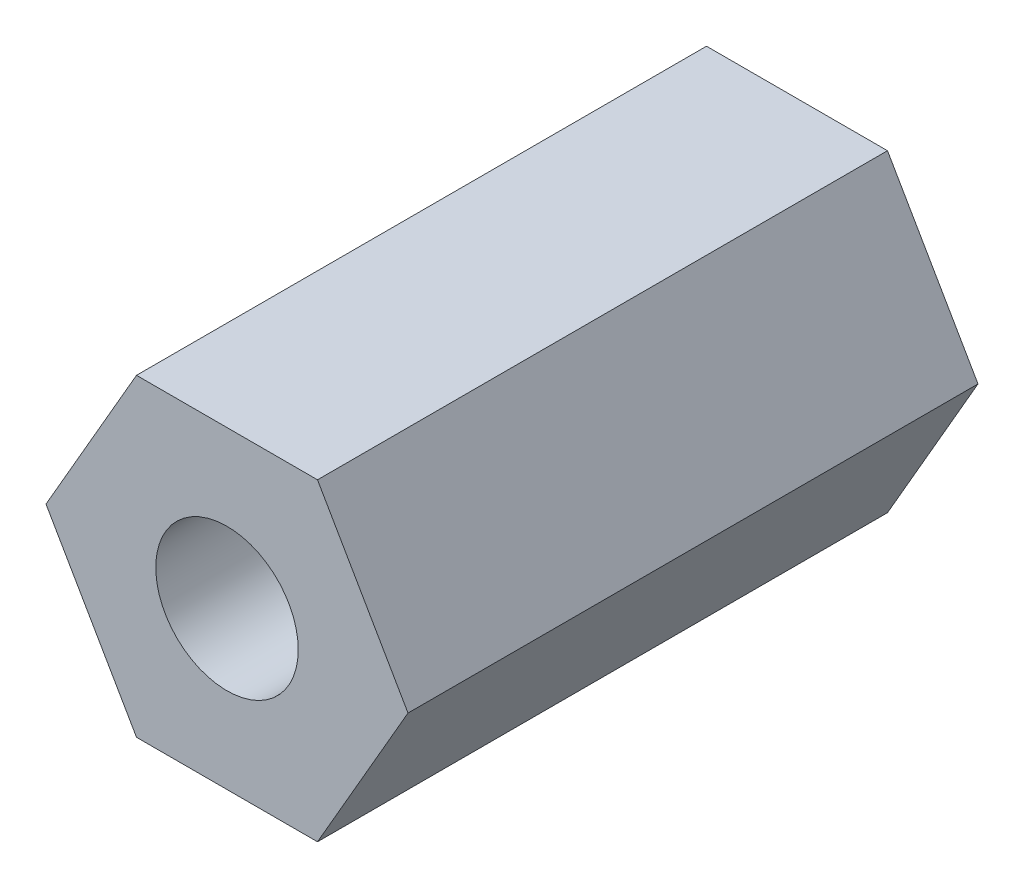
from build123d import *

# Parameters (mm, degrees)
F_5_5_MM_ACROSS_FLATS_AND_M3_TAP_BORE_R   = 1.25
M3_FEMALE_FEMALE_BRASS_SPACER_10_MM_DEPTH = 10


with BuildPart() as part:
    # 5.5 mm across flats and M3 tap bore → M3 female-female brass spacer 10 mm (new body)
    with BuildSketch(Plane.XY):
        Polygon((3.175426481, 0), (1.58771324, 2.75), (-1.58771324, 2.75), (-3.175426481, 0), (-1.58771324, -2.75), (1.58771324, -2.75), align=None)
        Circle(F_5_5_MM_ACROSS_FLATS_AND_M3_TAP_BORE_R, mode=Mode.SUBTRACT)
    extrude(amount=M3_FEMALE_FEMALE_BRASS_SPACER_10_MM_DEPTH)


solid = part.part
